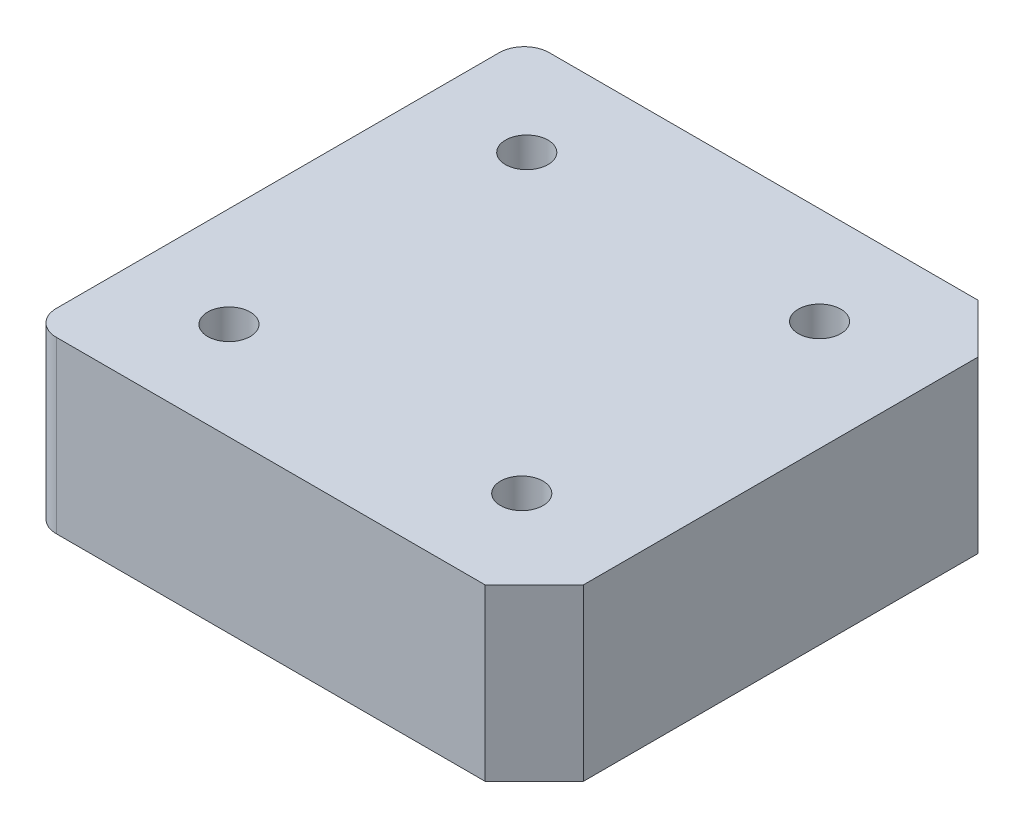
from build123d import *

# Parameters (mm, degrees)
SKETCH1_W           = 51.054
SKETCH1_H           = 50.038
BOSS_EXTRUDE1_DEPTH = 17.272
CHAMFER1_SIZE       = 5
FILLET1_R           = 2.54
SKETCH2_R           = 2.159
CUT_EXTRUDE1_DEPTH  = 48.875253562


with BuildPart() as part:
    # Sketch1 → Boss-Extrude1 (new body)
    with BuildSketch(Plane(origin=(0, 0, 0), x_dir=(1, 0, 0), z_dir=(0, 1, 0))):
        with Locations((-10.305704367, -1.621856169)):
            Rectangle(SKETCH1_W, SKETCH1_H)
    extrude(amount=BOSS_EXTRUDE1_DEPTH)

    # Chamfer1
    chamfer1_edges = [part.edges().sort_by_distance(p)[0] for p in [
        (15.221295633, 8.636, -23.397143831),
        (15.221295633, 8.636, 26.640856169),
    ]]
    chamfer(chamfer1_edges, length=CHAMFER1_SIZE)

    # Fillet1
    fillet1_edges = [part.edges().sort_by_distance(p)[0] for p in [
        (-35.832704367, 8.636, -23.397143831),
        (-35.832704367, 8.636, 26.640856169),
    ]]
    fillet(fillet1_edges, radius=FILLET1_R)

    # Sketch2 → Cut-Extrude1 (cut, through all)
    with BuildSketch(Plane(origin=(0, 17.272, 0), x_dir=(1, 0, 0), z_dir=(0, 1, 0))):
        with Locations(Location((-25.672704367, 13.491143831, 0), (0, 0, 270))):
            Circle(SKETCH2_R)
        with Locations(Location((4.045295633, 13.491143831, 0), (0, 0, 270))):
            Circle(SKETCH2_R)
        with Locations(Location((4.045295633, -16.734856169, 0), (0, 0, 270))):
            Circle(SKETCH2_R)
        with Locations(Location((-25.672704367, -16.734856169, 0), (0, 0, 270))):
            Circle(SKETCH2_R)
    extrude(amount=-CUT_EXTRUDE1_DEPTH, mode=Mode.SUBTRACT)


solid = part.part
